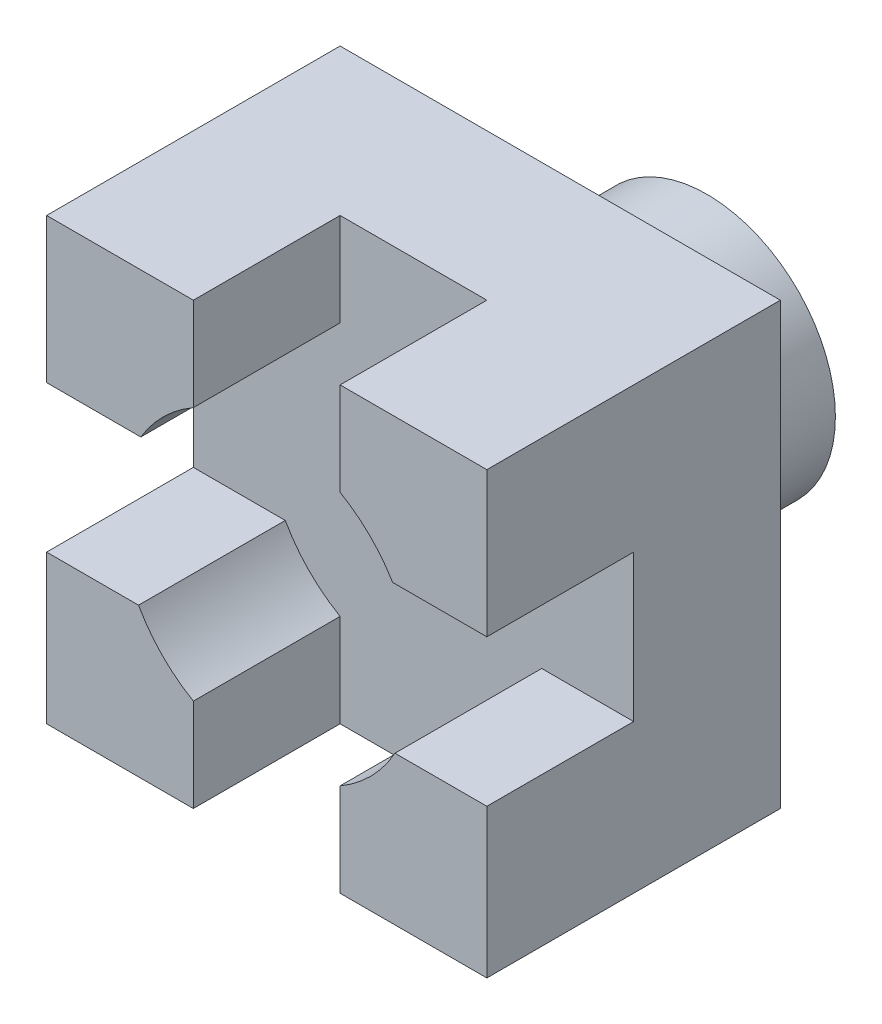
from build123d import *

# Parameters (mm, degrees)
SKETCH1_R           = 1.75
SKETCH1_R_2         = 1
BOSS_EXTRUDE1_DEPTH = 2
SKETCH4_W           = 6
SKETCH4_H           = 6
BOSS_EXTRUDE2_DEPTH = 4
SKETCH5_R           = 2
CUT_EXTRUDE4_DEPTH  = 2


with BuildPart() as part:
    # Sketch1 → Boss-Extrude1 (new body)
    with BuildSketch(Plane.XY):
        with Locations((-39.967897534, 24.79140814)):
            Circle(SKETCH1_R)
        with Locations((-39.967897534, 24.79140814)):
            Circle(SKETCH1_R_2, mode=Mode.SUBTRACT)
    extrude(amount=BOSS_EXTRUDE1_DEPTH)

    # Sketch4 → Boss-Extrude2 (add)
    with BuildSketch(Plane.XY.offset(2)):
        with Locations((-39.967897534, 24.79140814)):
            Rectangle(SKETCH4_W, SKETCH4_H)
    extrude(amount=BOSS_EXTRUDE2_DEPTH)

    # Sketch5 → Cut-Extrude4 (cut)
    with BuildSketch(Plane.XY.offset(6)):
        with Locations((-39.967897534, 24.79140814)):
            Circle(SKETCH5_R)
        Polygon((-36.967897534, 25.818240491), (-36.967897534, 23.818240491), (-39.967897534, 23.818240491), (-42.967897534, 23.818240491), (-42.967897534, 25.818240491), (-39.967897534, 25.818240491), align=None)
        Polygon((-40.967897534, 24.79140814), (-40.967897534, 27.79140814), (-38.967897534, 27.79140814), (-38.967897534, 24.79140814), (-38.967897534, 21.79140814), (-40.967897534, 21.79140814), align=None)
    extrude(amount=-CUT_EXTRUDE4_DEPTH, mode=Mode.SUBTRACT)


solid = part.part
